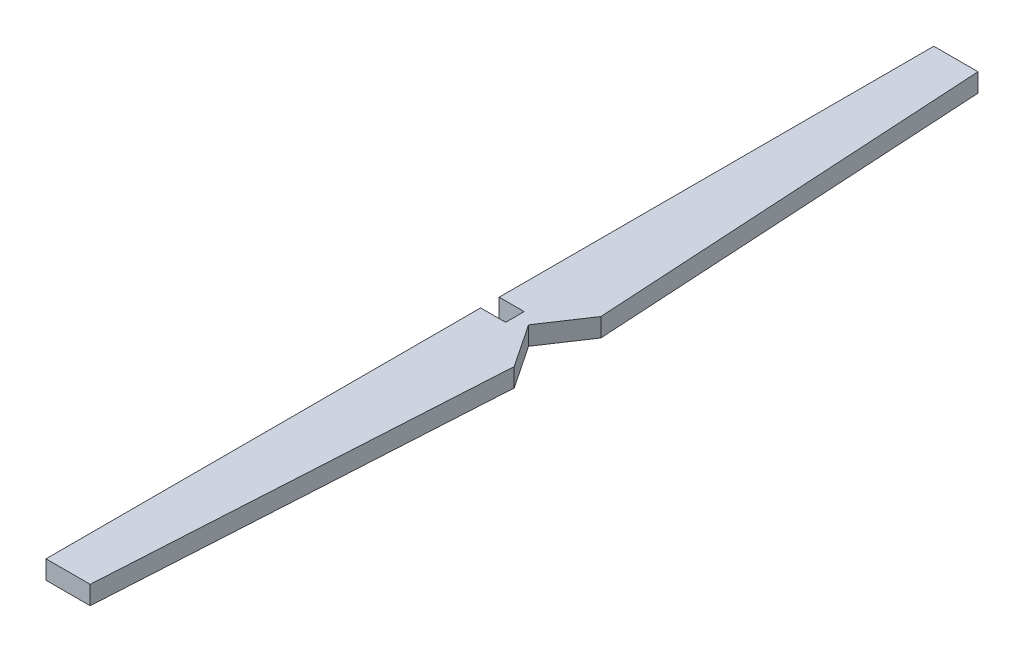
from build123d import *

# Parameters (mm, degrees)
BOSS_EXTRUDE1_DEPTH = 15
SCALE1_SCALE        = 0.6


with BuildPart() as part:
    # Sketch1 → Boss-Extrude1 (new body)
    with BuildSketch(Plane(origin=(0, 0, 0), x_dir=(1, 0, 0), z_dir=(0, 1, 0))):
        Polygon((0, 358.35), (0, 7.5), (20.180404561, 7.5), (20.180404561, -7.5), (0, -7.5), (0, -358.35), (35.650600343, -358.35), (54.572500068, -34.997934227), (31.19655837, 0), (54.572500068, 34.997934227), (35.650600343, 358.35), align=None)
    extrude(amount=BOSS_EXTRUDE1_DEPTH)


with BuildPart() as part_1:
    # Scale1: scaled about (22.921989844, 7.5, 0)
    add(part.part.scale(SCALE1_SCALE).moved(Location((9.168795938, 3, 0))))


solid = part_1.part
